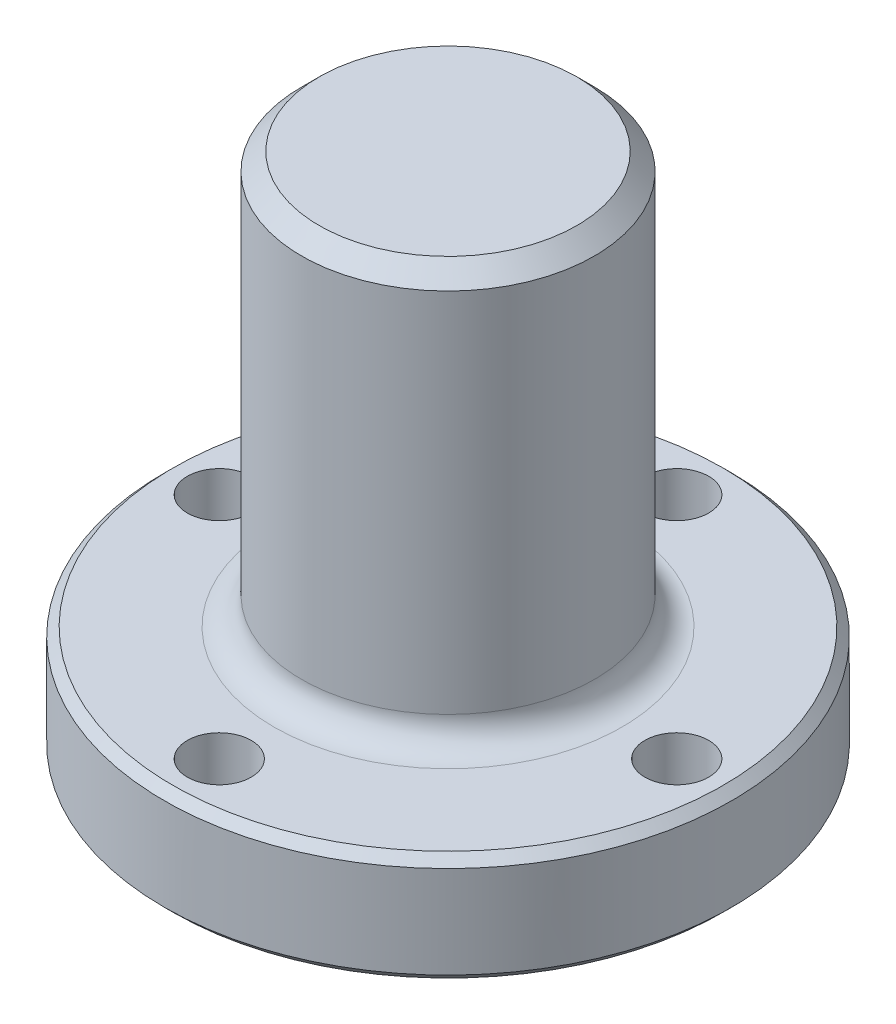
from build123d import *

# Parameters (mm, degrees)
FILLET1_R          = 2.3876
CHAMFER1_SIZE      = 0.762
CHAMFER2_SIZE      = 1.524
CUT_EXTRUDE2_REACH = 55.554
CUT_EXTRUDE2_START = -10.6807
SKETCH2_R          = 2.7686
CUT_EXTRUDE4_REACH = 55.554
CUT_EXTRUDE4_START = -10.6807
SKETCH3_R          = 2.7686


with BuildPart() as part:
    # Sketch1 → Revolve1 (revolve)
    with BuildSketch(Plane(origin=(0, 0, 0), x_dir=(0, 1, 0), z_dir=(0, 0, 1)), mode=Mode.PRIVATE) as revolve1_sk:
        Polygon((-25.0317, 0), (-25.0317, 8.7122), (-20.2057, 8.7122), (-20.2057, 24.6126), (-10.6807, 24.6126), (-10.6807, 12.7), (25.0317, 12.7), (25.0317, 0), align=None)
    revolve(revolve1_sk.sketch.rotate(Axis((0, -50.4317, 0), (0, 1, 0)), 270), axis=Axis((0, -50.4317, 0), (0, 1, 0)))

    # Fillet1
    fillet1_edges = [part.edges().sort_by_distance(p)[0] for p in [
        (0, -10.6807, 12.7),
    ]]
    fillet(fillet1_edges, radius=FILLET1_R)

    # Chamfer1
    chamfer1_edges = [part.edges().sort_by_distance(p)[0] for p in [
        (0, -10.6807, 24.6126),
        (0, -20.2057, 24.6126),
        (0, -25.0317, 8.7122),
    ]]
    chamfer(chamfer1_edges, length=CHAMFER1_SIZE)

    # Chamfer2
    chamfer2_edges = [part.edges().sort_by_distance(p)[0] for p in [
        (0, 25.0317, 12.7),
    ]]
    chamfer(chamfer2_edges, length=CHAMFER2_SIZE)

    # Sketch2 → Cut-Extrude2 (cut, up to next)
    with BuildSketch(Plane(origin=(0, 0, 0), x_dir=(-1, 0, 0), z_dir=(0, 1, 0)).offset(CUT_EXTRUDE2_START), mode=Mode.PRIVATE) as cut_extrude2_sk1:
        with Locations(Location((19.8374, 0, 0), (0, 0, 90))):
            Circle(SKETCH2_R)
    cut_extrude2_tool1 = extrude(cut_extrude2_sk1.sketch, amount=-CUT_EXTRUDE2_REACH, mode=Mode.PRIVATE) & part.part
    add(cut_extrude2_tool1.solids().sort_by_distance((-19.8374, -10.6807, 0))[0], mode=Mode.SUBTRACT)

    # Sketch3 → Cut-Extrude4 (cut, up to next)
    with BuildSketch(Plane(origin=(0, 0, 0), x_dir=(-1, 0, 0), z_dir=(0, 1, 0)).offset(CUT_EXTRUDE4_START), mode=Mode.PRIVATE) as cut_extrude4_sk1:
        with Locations(Location((0, 19.8374, 0), (0, 0, 90))):
            Circle(SKETCH3_R)
    cut_extrude4_tool1 = extrude(cut_extrude4_sk1.sketch, amount=-CUT_EXTRUDE4_REACH, mode=Mode.PRIVATE) & part.part
    # Sketch3 → Cut-Extrude4 (cut, up to next)
    with BuildSketch(Plane(origin=(0, 0, 0), x_dir=(-1, 0, 0), z_dir=(0, 1, 0)).offset(CUT_EXTRUDE4_START), mode=Mode.PRIVATE) as cut_extrude4_sk2:
        with Locations(Location((-19.8374, 0, 0), (0, 0, 90))):
            Circle(SKETCH3_R)
    cut_extrude4_tool2 = extrude(cut_extrude4_sk2.sketch, amount=-CUT_EXTRUDE4_REACH, mode=Mode.PRIVATE) & part.part
    # Sketch3 → Cut-Extrude4 (cut, up to next)
    with BuildSketch(Plane(origin=(0, 0, 0), x_dir=(-1, 0, 0), z_dir=(0, 1, 0)).offset(CUT_EXTRUDE4_START), mode=Mode.PRIVATE) as cut_extrude4_sk3:
        with Locations(Location((0, -19.8374, 0), (0, 0, 90))):
            Circle(SKETCH3_R)
    cut_extrude4_tool3 = extrude(cut_extrude4_sk3.sketch, amount=-CUT_EXTRUDE4_REACH, mode=Mode.PRIVATE) & part.part
    add(cut_extrude4_tool1.solids().sort_by_distance((0, -10.6807, 19.8374))[0], mode=Mode.SUBTRACT)
    add(cut_extrude4_tool2.solids().sort_by_distance((19.8374, -10.6807, 0))[0], mode=Mode.SUBTRACT)
    add(cut_extrude4_tool3.solids().sort_by_distance((0, -10.6807, -19.8374))[0], mode=Mode.SUBTRACT)


solid = part.part
